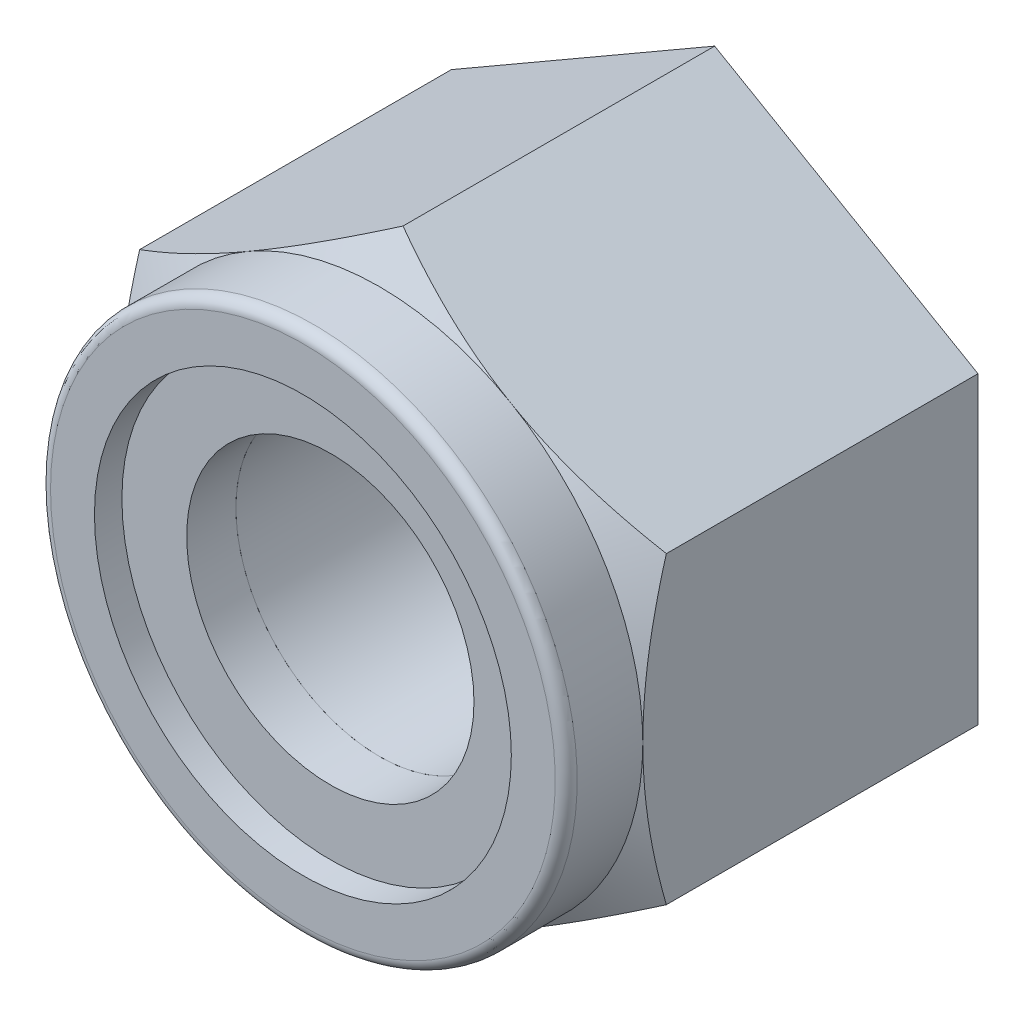
from build123d import *

# Parameters (mm, degrees)
EXTRUDE1_DEPTH     = 3.5
SKETCH5_R          = 2.463333333
SKETCH5_R_2        = 1.5
EXTRUDE2_DEPTH     = 0.513333333
SKETCH4_R          = 1.5
CUT_EXTRUDE1_DEPTH = 7.011308787
FILLET2_R          = 0.114666667


with BuildPart() as part:
    # Sketch1 → Extrude1 (new body)
    with BuildSketch(Plane.XY):
        Polygon((0, 3.175426481), (-2.75, 1.58771324), (-2.75, -1.58771324), (0, -3.175426481), (2.75, -1.58771324), (2.75, 1.58771324), align=None)
    extrude(amount=EXTRUDE1_DEPTH)

    # Sketch2 → Cut-Revolve1 (revolve, cut)
    with BuildSketch(Plane(origin=(0, 0, 0), x_dir=(1, 0, 0), z_dir=(0, 1, 0))):
        Polygon((2.75, -3.5), (3.85, -3.5), (3.85, -2.864914704), align=None)
    revolve(axis=Axis((0, 0, 0), (0, 0, 1)), mode=Mode.SUBTRACT)

    # Sketch3 → Revolve1 (revolve)
    with BuildSketch(Plane(origin=(0, 0, 0), x_dir=(1, 0, 0), z_dir=(0, 1, 0)), mode=Mode.PRIVATE) as revolve1_sk:
        Polygon((2.75, -3.5), (2.75, -4.3), (2.176666667, -4.3), (2.176666667, -4.013333333), (2.463333333, -4.013333333), (2.463333333, -3.5), align=None)
    revolve(revolve1_sk.sketch.rotate(Axis((0, 0, 0), (0, 0, 1)), 180), axis=Axis((0, 0, 0), (0, 0, 1)))

    # Sketch4 → Cut-Extrude1 (cut, through all)
    with BuildSketch(Plane(origin=(0, 0, 0), x_dir=(-1, 0, 0), z_dir=(0, 0, -1))):
        with Locations(Location((0, 0, 0), (0, 0, 180))):
            Circle(SKETCH4_R)
    extrude(amount=-CUT_EXTRUDE1_DEPTH, mode=Mode.SUBTRACT)

    # Fillet2
    fillet2_edges = [part.edges().sort_by_distance(p)[0] for p in [
        (2.75, 0, 4.3),
    ]]
    fillet(fillet2_edges, radius=FILLET2_R)


with BuildPart() as body_2:
    # Sketch5 → Extrude2 (new body)
    with BuildSketch(Plane.XY.offset(3.5)):
        Circle(SKETCH5_R)
        Circle(SKETCH5_R_2, mode=Mode.SUBTRACT)
    extrude(amount=EXTRUDE2_DEPTH)


solid = Compound([part.part, body_2.part])
